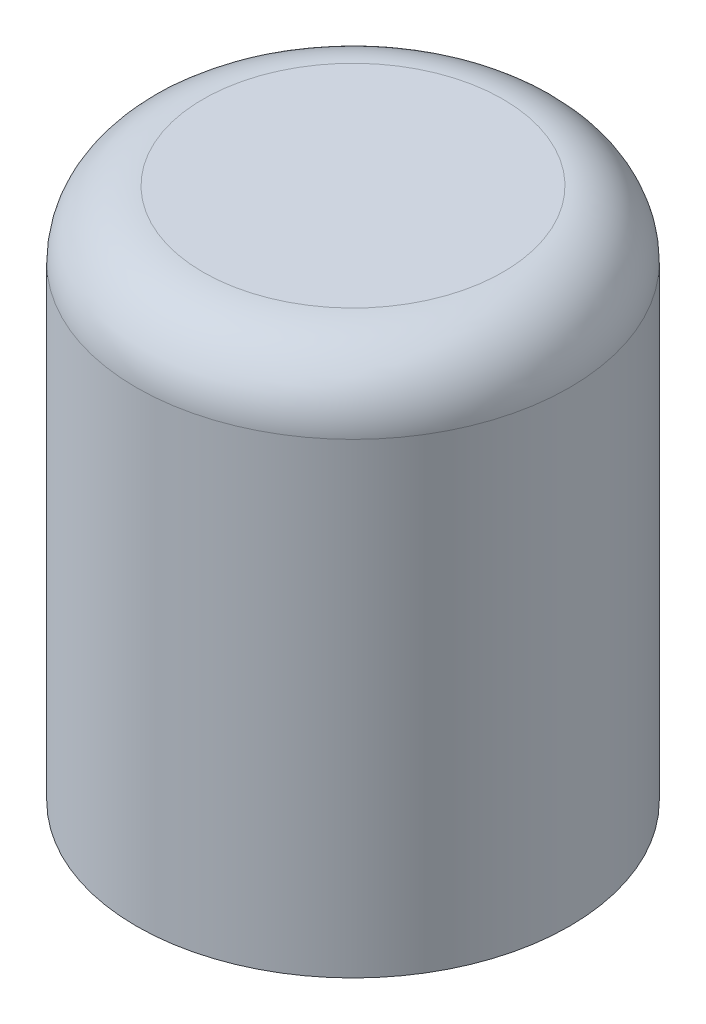
from build123d import *

# Parameters (mm, degrees)
SKETCH1_R           = 3.25
BOSS_EXTRUDE1_DEPTH = 8
FILLET1_R           = 1
SKETCH2_R           = 1.65
CUT_EXTRUDE1_DEPTH  = 5
CUT_EXTRUDE1_DRAFT  = -1.7


with BuildPart() as part:
    # Sketch1 → Boss-Extrude1 (new body)
    with BuildSketch(Plane(origin=(0, 0, 0), x_dir=(1, 0, 0), z_dir=(0, 1, 0))):
        with Locations(Location((0, 0, 0), (0, 0, 270))):
            Circle(SKETCH1_R)
    extrude(amount=BOSS_EXTRUDE1_DEPTH)

    # Fillet1
    fillet1_edges = [part.edges().sort_by_distance(p)[0] for p in [
        (0, 8, -3.25),
    ]]
    fillet(fillet1_edges, radius=FILLET1_R)


with BuildPart() as cut_extrude1_tool:
    # Sketch2 → Cut-Extrude1 (with draft: the straight prism first)
    with BuildSketch(Plane.XZ):
        Circle(SKETCH2_R)
    extrude(amount=-CUT_EXTRUDE1_DEPTH)
    # Cut-Extrude1: the draft: its side faces are tilted about the plane it starts from
    cut_extrude1_sides = [cut_extrude1_tool.faces().sort_by_distance(p)[0] for p in [
        (-1.65, 2.5, 0),
    ]]
    draft(cut_extrude1_sides, Plane.XZ, CUT_EXTRUDE1_DRAFT)


with BuildPart() as part_1:
    add(part.part)

    # Cut-Extrude1: cut by cut_extrude1_tool
    add(cut_extrude1_tool.part, mode=Mode.SUBTRACT)


solid = part_1.part
